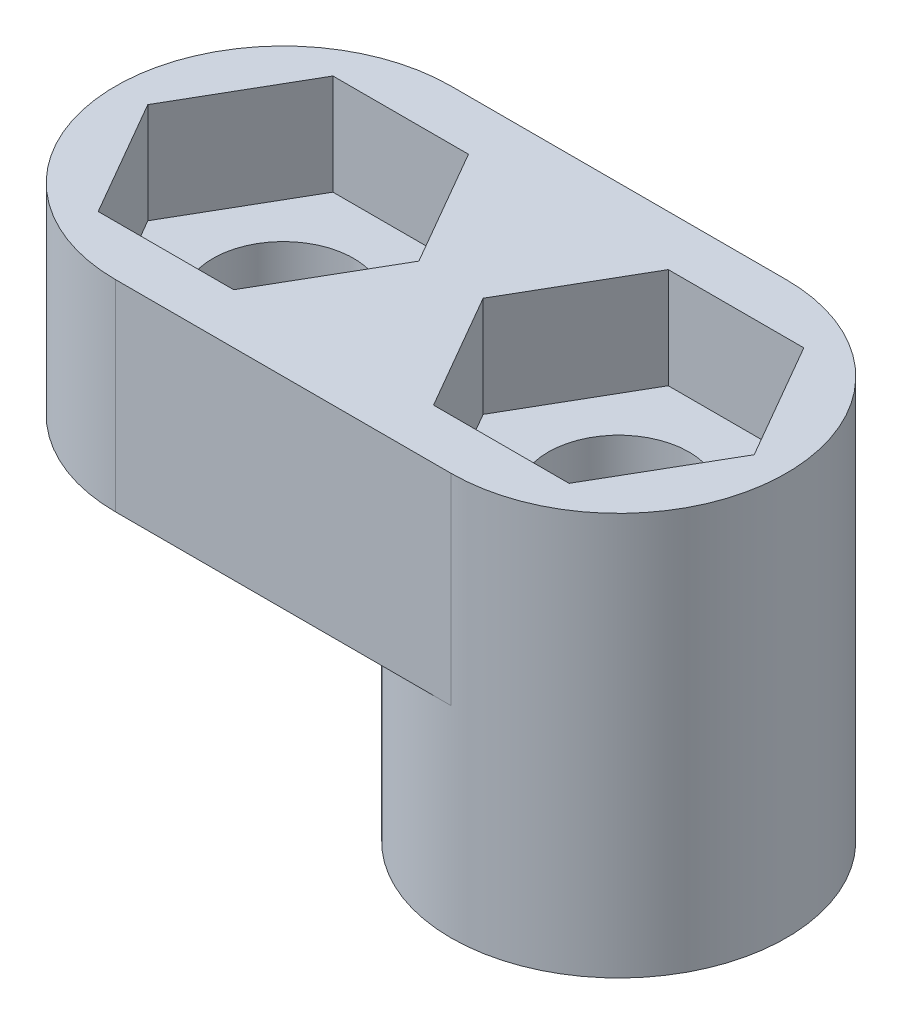
from build123d import *

# Parameters (mm, degrees)
SKETCH1_R           = 2.1
BOSS_EXTRUDE1_DEPTH = 3
CUT_EXTRUDE1_DEPTH  = 3
SKETCH3_R           = 5
SKETCH3_R_2         = 2.1
BOSS_EXTRUDE2_DEPTH = 6


with BuildPart() as part:
    # Sketch1 → Boss-Extrude1 (new, symmetric)
    with BuildSketch(Plane(origin=(0, 0, 0), x_dir=(1, 0, 0), z_dir=(0, 1, 0))):
        with BuildLine():
            Line((-5, 5), (5, 5))
            ThreePointArc((5, 5), (10, 0), (5, -5))
            Line((5, -5), (-5, -5))
            ThreePointArc((-5, -5), (-10, 0), (-5, 5))
        make_face()
        with Locations(Location((5, 0, 0), (0, 0, 270))):
            Circle(SKETCH1_R, mode=Mode.SUBTRACT)
        with Locations(Location((-5, 0, 0), (0, 0, 270))):
            Circle(SKETCH1_R, mode=Mode.SUBTRACT)
    extrude(amount=BOSS_EXTRUDE1_DEPTH, both=True)

    # Sketch2 → Cut-Extrude1 (cut)
    with BuildSketch(Plane(origin=(0, 3, 0), x_dir=(1, 0, 0), z_dir=(0, 1, 0))):
        Polygon((-9.041451884, 0), (-7.020725942, -3.5), (-2.979274058, -3.5), (-0.958548116, 0), (-2.979274058, 3.5), (-7.020725942, 3.5), align=None)
        Polygon((9.041451884, 0), (7.020725942, 3.5), (2.979274058, 3.5), (0.958548116, 0), (2.979274058, -3.5), (7.020725942, -3.5), align=None)
    extrude(amount=-CUT_EXTRUDE1_DEPTH, mode=Mode.SUBTRACT)

    # Sketch3 → Boss-Extrude2 (add)
    with BuildSketch(Plane.XZ.offset(3)):
        with Locations(Location((5, 0, 0), (0, 0, 270))):
            Circle(SKETCH3_R)
        with Locations(Location((5, 0, 0), (0, 0, 270))):
            Circle(SKETCH3_R_2, mode=Mode.SUBTRACT)
    extrude(amount=BOSS_EXTRUDE2_DEPTH)


solid = part.part
